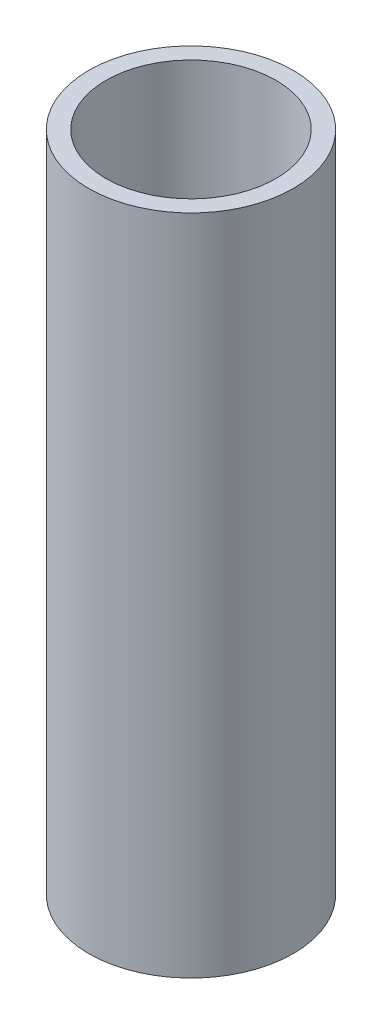
from build123d import *

# Parameters (mm, degrees)
SKETCH1_R           = 21.082
SKETCH1_R_2         = 17.526
BOSS_EXTRUDE1_DEPTH = 136.525


with BuildPart() as part:
    # Sketch1 → Boss-Extrude1 (new body)
    with BuildSketch(Plane(origin=(0, 0, 0), x_dir=(1, 0, 0), z_dir=(0, 1, 0))):
        with Locations(Location((0, 0, 0), (0, 0, 270))):
            Circle(SKETCH1_R)
        with Locations(Location((0, 0, 0), (0, 0, 270))):
            Circle(SKETCH1_R_2, mode=Mode.SUBTRACT)
    extrude(amount=BOSS_EXTRUDE1_DEPTH)


solid = part.part
